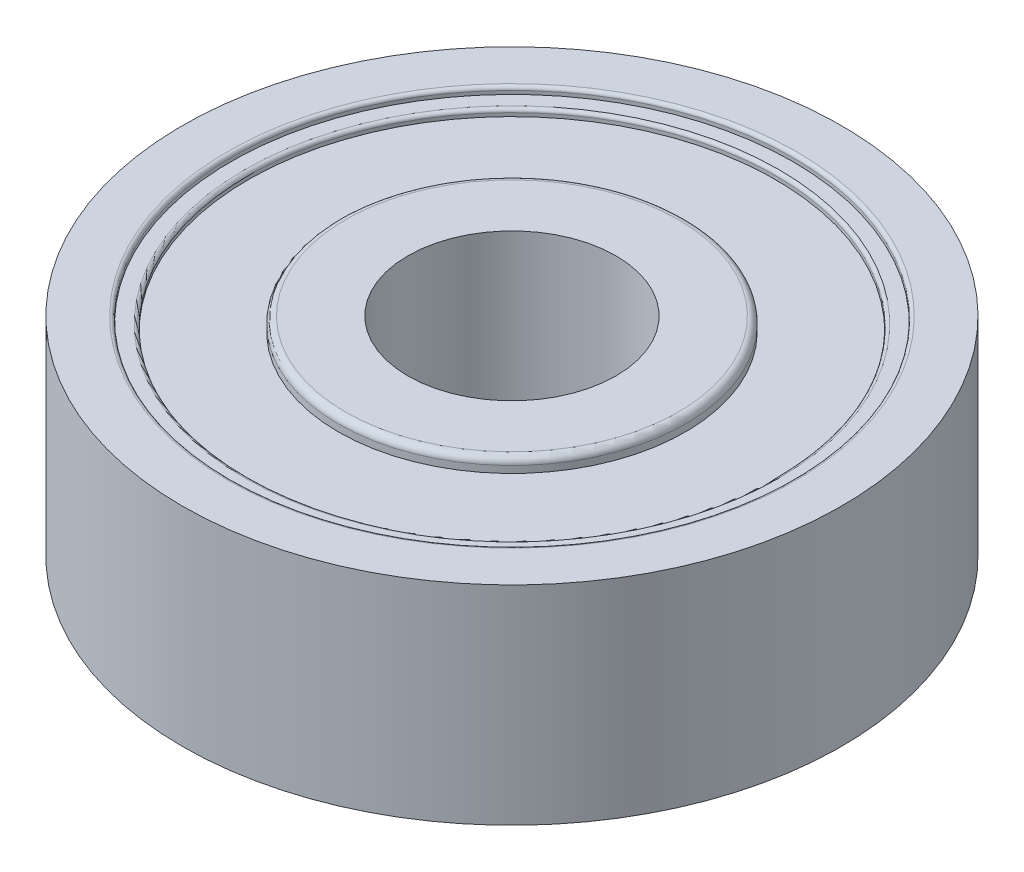
from build123d import *

# Parameters (mm, degrees)
ESBO_O1_R                = 9.5
RESSALTO_EXTRUS_O1_DEPTH = 6
ESBO_O2_R                = 3
CORTE_EXTRUS_O1_DEPTH    = 6
ESBO_O3_R                = 8.1
ESBO_O3_R_2              = 7.6
CORTE_EXTRUS_O2_DEPTH    = 0.2
ESBO_O4_R                = 7.6
ESBO_O4_R_2              = 5
CORTE_EXTRUS_O3_DEPTH    = 0.4
FILETE1_R                = 0.2
FILETE2_R                = 0.1
ESBO_O5_W                = 19.615918828
ESBO_O5_H                = 3
CORTE_EXTRUS_O4_DEPTH    = 12


with BuildPart() as part:
    # Esboço1 → Ressalto-extrusão1 (new body)
    with BuildSketch(Plane(origin=(0, 0, 0), x_dir=(1, 0, 0), z_dir=(0, 1, 0))):
        with Locations(Location((0, 0, 0), (0, 0, 270))):
            Circle(ESBO_O1_R)
    extrude(amount=RESSALTO_EXTRUS_O1_DEPTH)

    # Esboço2 → Corte-extrusão1 (cut)
    with BuildSketch(Plane(origin=(0, 6, 0), x_dir=(1, 0, 0), z_dir=(0, 1, 0))):
        with Locations(Location((0, 0, 0), (0, 0, 270))):
            Circle(ESBO_O2_R)
    extrude(amount=-CORTE_EXTRUS_O1_DEPTH, mode=Mode.SUBTRACT)

    # Esboço3 → Corte-extrusão2 (cut)
    with BuildSketch(Plane(origin=(0, 6, 0), x_dir=(1, 0, 0), z_dir=(0, 1, 0))):
        with Locations(Location((0, 0, 0), (0, 0, 270))):
            Circle(ESBO_O3_R)
        with Locations(Location((0, 0, 0), (0, 0, 270))):
            Circle(ESBO_O3_R_2, mode=Mode.SUBTRACT)
    extrude(amount=-CORTE_EXTRUS_O2_DEPTH, mode=Mode.SUBTRACT)

    # Esboço4 → Corte-extrusão3 (cut)
    with BuildSketch(Plane(origin=(0, 6, 0), x_dir=(1, 0, 0), z_dir=(0, 1, 0))):
        with Locations(Location((0, 0, 0), (0, 0, 270))):
            Circle(ESBO_O4_R)
        with Locations(Location((0, 0, 0), (0, 0, 270))):
            Circle(ESBO_O4_R_2, mode=Mode.SUBTRACT)
    extrude(amount=-CORTE_EXTRUS_O3_DEPTH, mode=Mode.SUBTRACT)

    # Filete1
    filete1_edges = [part.edges().sort_by_distance(p)[0] for p in [
        (0, 6, -5),
    ]]
    fillet(filete1_edges, radius=FILETE1_R)

    # Filete2
    filete2_edges = [part.edges().sort_by_distance(p)[0] for p in [
        (0, 6, -8.1),
        (0, 5.8, -7.6),
    ]]
    fillet(filete2_edges, radius=FILETE2_R)

    # Esboço5 → Corte-extrusão4 (cut, symmetric)
    with BuildSketch(Plane.XY):
        with Locations((0.307959414, 1.5)):
            Rectangle(ESBO_O5_W, ESBO_O5_H)
    extrude(amount=CORTE_EXTRUS_O4_DEPTH, both=True, mode=Mode.SUBTRACT)

    # Espelhar7: part across plane


with BuildPart() as part_1:
    add(part.part)
    add(part.part.mirror(Plane.ZX.offset(3)))


solid = part_1.part
